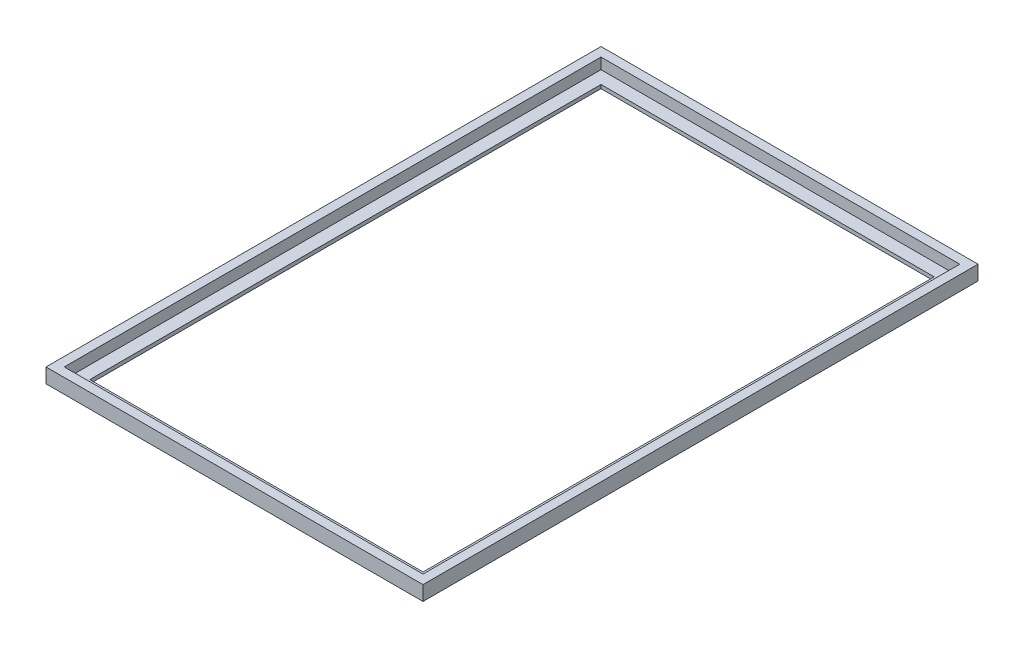
from build123d import *

# Parameters (mm, degrees)
SKETCH1_W           = 206.5
SKETCH1_H           = 304
SKETCH1_W_2         = 182.5
SKETCH1_H_2         = 280
BOSS_EXTRUDE1_DEPTH = 2
SKETCH2_W           = 206.5
SKETCH2_H           = 304
SKETCH2_W_2         = 196.5
SKETCH2_H_2         = 294
BOSS_EXTRUDE2_DEPTH = 6


with BuildPart() as part:
    # Sketch1 → Boss-Extrude1 (new body)
    with BuildSketch(Plane(origin=(0, 0, 0), x_dir=(1, 0, 0), z_dir=(0, 1, 0))):
        Rectangle(SKETCH1_W, SKETCH1_H)
        Rectangle(SKETCH1_W_2, SKETCH1_H_2, mode=Mode.SUBTRACT)
    extrude(amount=BOSS_EXTRUDE1_DEPTH)

    # Sketch2 → Boss-Extrude2 (add)
    with BuildSketch(Plane(origin=(0, 2, 0), x_dir=(1, 0, 0), z_dir=(0, 1, 0))):
        Rectangle(SKETCH2_W, SKETCH2_H)
        Rectangle(SKETCH2_W_2, SKETCH2_H_2, mode=Mode.SUBTRACT)
    extrude(amount=BOSS_EXTRUDE2_DEPTH)


solid = part.part
